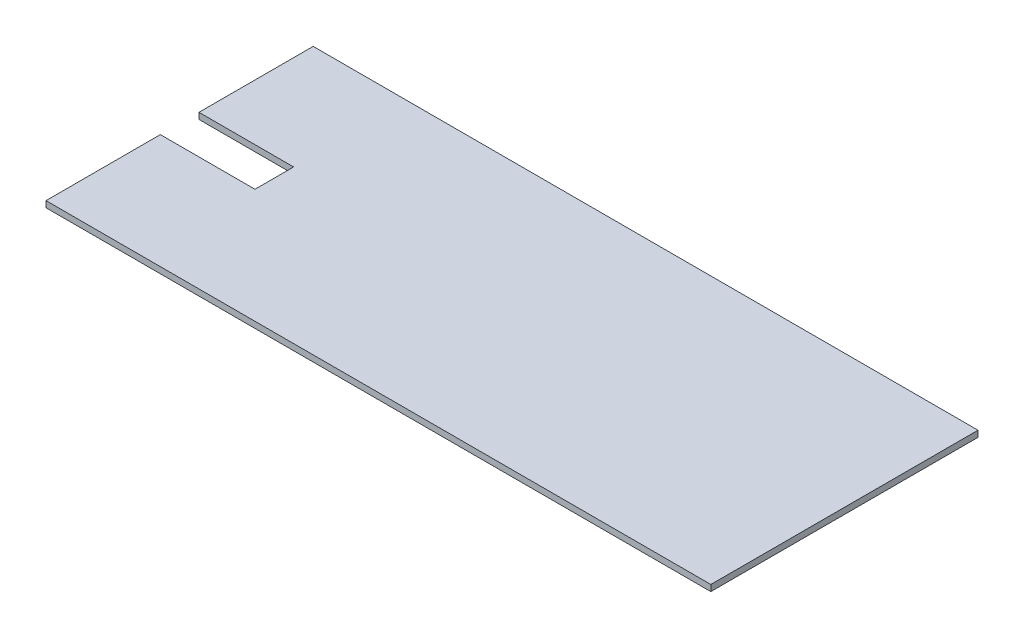
from build123d import *

# Parameters (mm, degrees)
EXTRUDE_1_DEPTH = 2


with BuildPart() as part:
    # Эскиз1 → Вытянуть1 (new body)
    with BuildSketch(Plane(origin=(0, 0, 0), x_dir=(1, 0, 0), z_dir=(0, 1, 0))):
        Polygon((1, -33.776259489), (31.466634363, -33.776259489), (31.466634363, -46.212870139), (1, -46.212870139), (1, -83.015295197), (215, -83.015295197), (215, 2.984704803), (1, 2.984704803), align=None)
    extrude(amount=EXTRUDE_1_DEPTH)


solid = part.part
